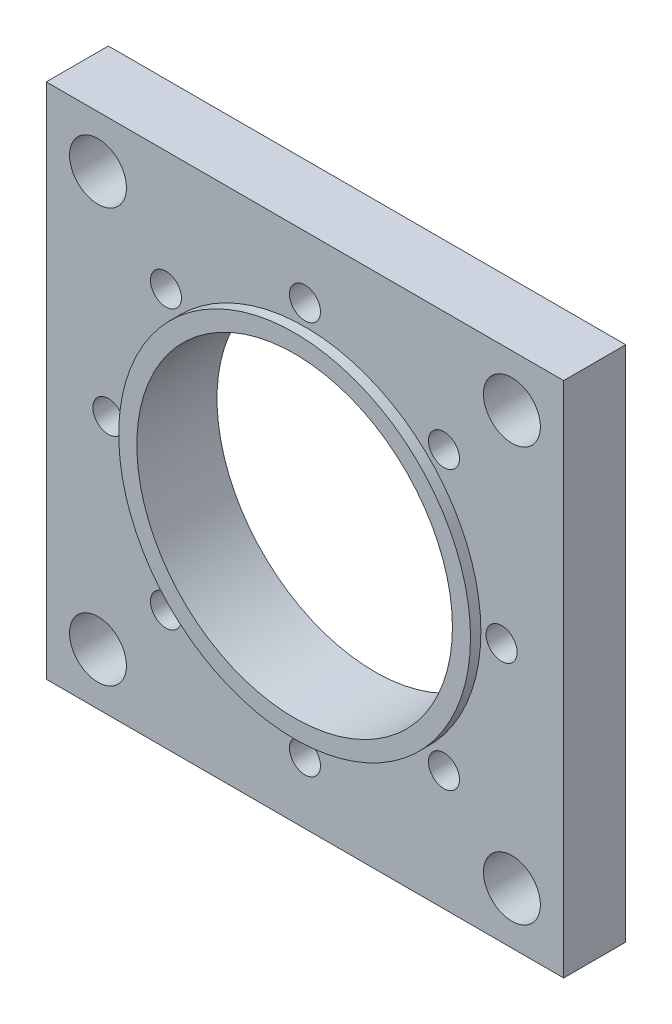
from build123d import *

# Parameters (mm, degrees)
SKETCH_1_W                   = 100
SKETCH_1_H                   = 100
EXTRUDE_1_DEPTH              = 7.75
SKETCH_2_R                   = 30.5
CUT_EXTRUDE_1_DEPTH          = 17
SKETCH_3_W                   = 100
SKETCH_3_H                   = 100
SKETCH_3_R                   = 34
CUT_EXTRUDE_2_DEPTH          = 2
SKETCH_4_W                   = 100
SKETCH_4_H                   = 100
SKETCH_4_R                   = 47.5
CUT_EXTRUDE_3_DEPTH          = 1.5
HOLE_WIZARD_M6_1_D           = 6
HOLE_WIZARD_M6_1_CBORE_D     = 10
HOLE_WIZARD_M6_1_CBORE_DEPTH = 6
PATTERN_CIRCULAR_1_COUNT     = 8
CUT_EXTRUDE_4_REACH          = 74.083
SKETCH_8_R                   = 5.5


with BuildPart() as part:
    # 草图1 → 凸台-拉伸1 (new, symmetric)
    with BuildSketch(Plane.XY):
        Rectangle(SKETCH_1_W, SKETCH_1_H)
    extrude(amount=EXTRUDE_1_DEPTH, both=True)

    # 草图2 → 切除-拉伸1 (cut)
    with BuildSketch(Plane.XY.offset(7.75)):
        Circle(SKETCH_2_R)
    extrude(amount=-CUT_EXTRUDE_1_DEPTH, mode=Mode.SUBTRACT)

    # 草图3 → 切除-拉伸2 (cut)
    with BuildSketch(Plane.XY.offset(7.75)):
        Rectangle(SKETCH_3_W, SKETCH_3_H)
        Circle(SKETCH_3_R, mode=Mode.SUBTRACT)
    extrude(amount=-CUT_EXTRUDE_2_DEPTH, mode=Mode.SUBTRACT)

    # 草图4 → 切除-拉伸3 (cut)
    with BuildSketch(Plane(origin=(0, 0, -7.75), x_dir=(-1, 0, 0), z_dir=(0, 0, -1))):
        Rectangle(SKETCH_4_W, SKETCH_4_H)
        Circle(SKETCH_4_R, mode=Mode.SUBTRACT)
    extrude(amount=-CUT_EXTRUDE_3_DEPTH, mode=Mode.SUBTRACT)

    # M6 六角头螺栓的柱形沉头孔1 (through all)
    with Locations(Plane(origin=(0, 0, -7.75), x_dir=(-1, 0, 0), z_dir=(0, 0, -1))):
        with Locations((0, 38)):
            hole_wizard_m6_1 = CounterBoreHole(HOLE_WIZARD_M6_1_D / 2, HOLE_WIZARD_M6_1_CBORE_D / 2, HOLE_WIZARD_M6_1_CBORE_DEPTH)

    # 阵列(圆周)1: M6 六角头螺栓的柱形沉头孔1 ×8 about axis
    pattern_circular_1_axis = Axis((0, 0, 0), (0, 0, 1))
    for i in range(1, PATTERN_CIRCULAR_1_COUNT):
        add(hole_wizard_m6_1.rotate(pattern_circular_1_axis, i * 360 / PATTERN_CIRCULAR_1_COUNT), mode=Mode.SUBTRACT)

    # 草图8 → 切除-拉伸4 (cut, up to next)
    with BuildSketch(Plane(origin=(0, 0, -6.25), x_dir=(-1, 0, 0), z_dir=(0, 0, -1)), mode=Mode.PRIVATE) as cut_extrude_4_sk1:
        with Locations((40, 40)):
            Circle(SKETCH_8_R)
    cut_extrude_4_tool1 = extrude(cut_extrude_4_sk1.sketch, amount=-CUT_EXTRUDE_4_REACH, mode=Mode.PRIVATE) & part.part
    # 草图8 → 切除-拉伸4 (cut, up to next)
    with BuildSketch(Plane(origin=(0, 0, -6.25), x_dir=(-1, 0, 0), z_dir=(0, 0, -1)), mode=Mode.PRIVATE) as cut_extrude_4_sk2:
        with Locations((40, -40)):
            Circle(SKETCH_8_R)
    cut_extrude_4_tool2 = extrude(cut_extrude_4_sk2.sketch, amount=-CUT_EXTRUDE_4_REACH, mode=Mode.PRIVATE) & part.part
    # 草图8 → 切除-拉伸4 (cut, up to next)
    with BuildSketch(Plane(origin=(0, 0, -6.25), x_dir=(-1, 0, 0), z_dir=(0, 0, -1)), mode=Mode.PRIVATE) as cut_extrude_4_sk3:
        with Locations((-40, -40)):
            Circle(SKETCH_8_R)
    cut_extrude_4_tool3 = extrude(cut_extrude_4_sk3.sketch, amount=-CUT_EXTRUDE_4_REACH, mode=Mode.PRIVATE) & part.part
    # 草图8 → 切除-拉伸4 (cut, up to next)
    with BuildSketch(Plane(origin=(0, 0, -6.25), x_dir=(-1, 0, 0), z_dir=(0, 0, -1)), mode=Mode.PRIVATE) as cut_extrude_4_sk4:
        with Locations((-40, 40)):
            Circle(SKETCH_8_R)
    cut_extrude_4_tool4 = extrude(cut_extrude_4_sk4.sketch, amount=-CUT_EXTRUDE_4_REACH, mode=Mode.PRIVATE) & part.part
    add(cut_extrude_4_tool1.solids().sort_by_distance((-40, 40, -6.25))[0], mode=Mode.SUBTRACT)
    add(cut_extrude_4_tool2.solids().sort_by_distance((-40, -40, -6.25))[0], mode=Mode.SUBTRACT)
    add(cut_extrude_4_tool3.solids().sort_by_distance((40, -40, -6.25))[0], mode=Mode.SUBTRACT)
    add(cut_extrude_4_tool4.solids().sort_by_distance((40, 40, -6.25))[0], mode=Mode.SUBTRACT)


solid = part.part
